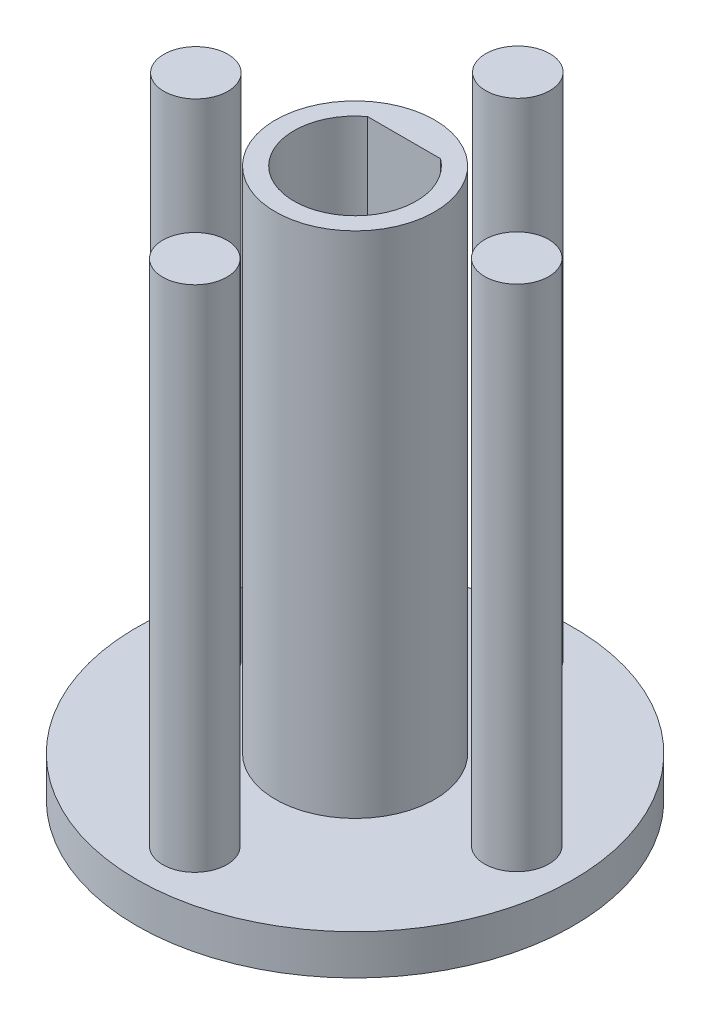
from build123d import *

# Parameters (mm, degrees)
SKETCH3_R             = 1.6
BOSS_EXTRUDE1_DEPTH   = 27.4
BOSS_EXTRUDE1_2_DEPTH = 27.4
BOSS_EXTRUDE1_3_DEPTH = 27.4
BOSS_EXTRUDE1_4_DEPTH = 27.4
SKETCH3_R_2           = 3.975
BOSS_EXTRUDE1_5_DEPTH = 27.4
SKETCH3_17_R          = 10.9
BOSS_EXTRUDE2_DEPTH   = 2


with BuildPart() as part:
    # Sketch3 → Boss-Extrude1 (new body)
    with BuildSketch(Plane(origin=(0, 0, 0), x_dir=(1, 0, 0), z_dir=(0, 1, 0))):
        with Locations((0.009034474, 8.115584077)):
            Circle(SKETCH3_R)
    extrude(amount=BOSS_EXTRUDE1_DEPTH)



with BuildPart() as body_2:
    # Sketch3 → Boss-Extrude1 2 (new body)
    with BuildSketch(Plane(origin=(0, 0, 0), x_dir=(1, 0, 0), z_dir=(0, 1, 0))):
        with Locations((8.017679827, 0.053335715)):
            Circle(SKETCH3_R)
    extrude(amount=BOSS_EXTRUDE1_2_DEPTH)


with BuildPart() as body_3:
    # Sketch3 → Boss-Extrude1 3 (new body)
    with BuildSketch(Plane(origin=(0, 0, 0), x_dir=(1, 0, 0), z_dir=(0, 1, 0))):
        with Locations((0.009179949, -8.009057152)):
            Circle(SKETCH3_R)
    extrude(amount=BOSS_EXTRUDE1_3_DEPTH)


with BuildPart() as body_4:
    # Sketch3 → Boss-Extrude1 4 (new body)
    with BuildSketch(Plane(origin=(0, 0, 0), x_dir=(1, 0, 0), z_dir=(0, 1, 0))):
        with Locations((-7.999465404, 0.05319121)):
            Circle(SKETCH3_R)
    extrude(amount=BOSS_EXTRUDE1_4_DEPTH)


with BuildPart() as body_5:
    # Sketch3 → Boss-Extrude1 5 (new body)
    with BuildSketch(Plane(origin=(0, 0, 0), x_dir=(1, 0, 0), z_dir=(0, 1, 0))):
        Circle(SKETCH3_R_2)
        with BuildLine():
            Line((-1.823098343, 2.445161023), (1.823098343, 2.445161023))
            ThreePointArc((1.823098343, 2.445161023), (0, -3.05), (-1.823098343, 2.445161023))
        make_face(mode=Mode.SUBTRACT)
    extrude(amount=BOSS_EXTRUDE1_5_DEPTH)


with BuildPart() as part_1:
    add(part.part)

    add(body_2.part)  # Boss-Extrude2 merges body 2

    add(body_3.part)  # Boss-Extrude2 merges body 3

    add(body_4.part)  # Boss-Extrude2 merges body 4

    add(body_5.part)  # Boss-Extrude2 merges body 5
    # Sketch3<17> → Boss-Extrude2 (add)
    with BuildSketch(Plane(origin=(0, 0, 0), x_dir=(1, 0, 0), z_dir=(0, 1, 0))):
        Circle(SKETCH3_17_R)
    extrude(amount=BOSS_EXTRUDE2_DEPTH)


solid = part_1.part
